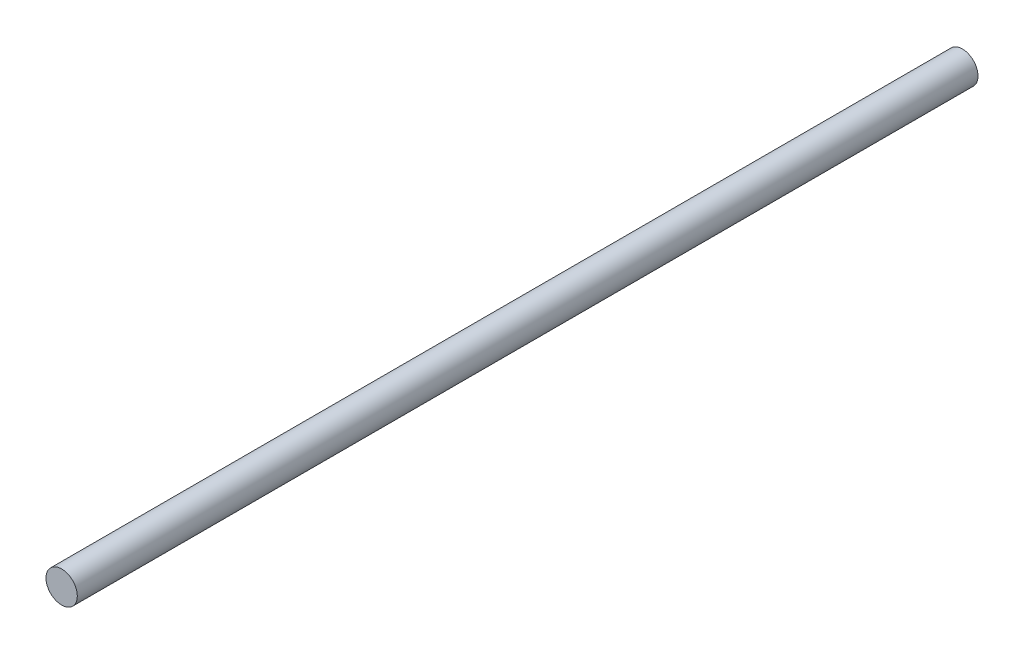
from build123d import *

# Parameters (mm, degrees)
SKETCH2_R           = 4
BOSS_EXTRUDE1_DEPTH = 300
CUT_EXTRUDE1_START  = -70
SKETCH3_R           = 4
CUT_EXTRUDE1_DEPTH  = 70


with BuildPart() as part:
    # Sketch2 → Boss-Extrude1 (new body)
    with BuildSketch(Plane(origin=(0, 0, 18), x_dir=(-1, 0, 0), z_dir=(0, 0, -1))):
        with Locations(Location((0, 0, 0), (0, 0, 90))):
            Circle(SKETCH2_R)
    extrude(amount=-BOSS_EXTRUDE1_DEPTH)

    # Sketch3 → Cut-Extrude1 (cut)
    with BuildSketch(Plane.XY.offset(318).offset(CUT_EXTRUDE1_START)):
        with Locations(Location((0, 0, 0), (0, 0, 90))):
            Circle(SKETCH3_R)
    extrude(amount=CUT_EXTRUDE1_DEPTH, mode=Mode.SUBTRACT)


solid = part.part
